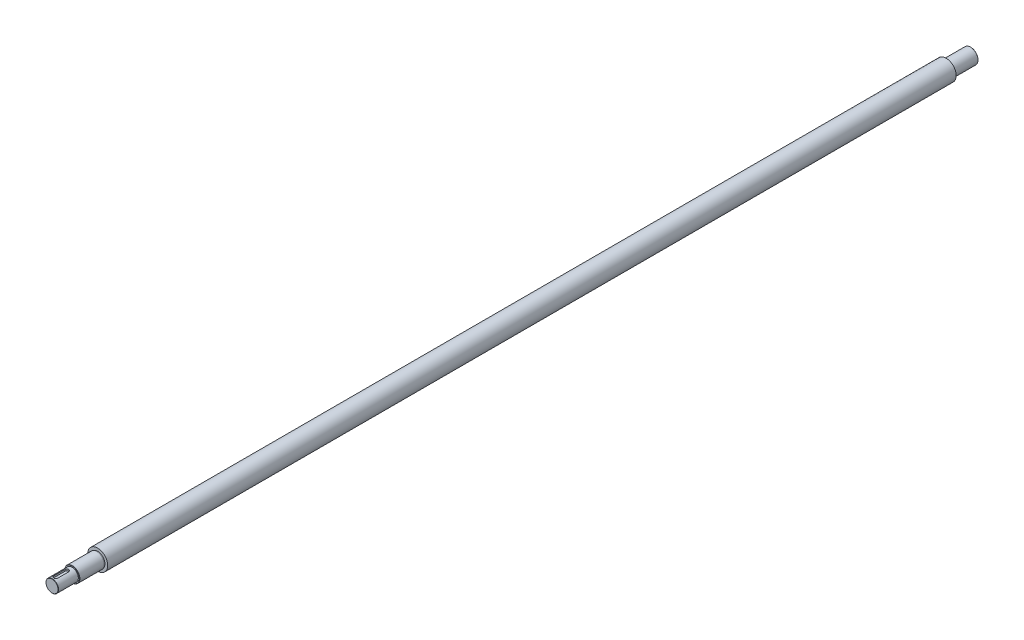
from build123d import *

# Parameters (mm, degrees)
SKETCH_1_R          = 12.5
EXTRUDE_1_DEPTH     = 40
CHAMFER_1_SIZE      = 0.5
SKETCH_2_R          = 15
EXTRUDE_2_DEPTH     = 49
CHAMFER_2_SIZE      = 0.5
CUT_EXTRUDE_1_DEPTH = 4
SKETCH_11_R         = 14.5
EXTRUDE_3_DEPTH     = 2
SKETCH_12_R         = 20
EXTRUDE_4_DEPTH     = 1691
SKETCH_13_R         = 14.5
EXTRUDE_5_DEPTH     = 2
SKETCH_14_R         = 15
EXTRUDE_6_DEPTH     = 47
CHAMFER_3_SIZE      = 0.5


with BuildPart() as part:
    # 草图1 → 凸台-拉伸1 (new body)
    with BuildSketch(Plane.XY):
        Circle(SKETCH_1_R)
    extrude(amount=EXTRUDE_1_DEPTH)

    # 倒角1
    chamfer_1_edges = [part.edges().sort_by_distance(p)[0] for p in [
        (-12.5, 0, 40),
    ]]
    chamfer(chamfer_1_edges, length=CHAMFER_1_SIZE)

    # 草图2 → 凸台-拉伸2 (add)
    with BuildSketch(Plane(origin=(0, 0, 0), x_dir=(-1, 0, 0), z_dir=(0, 0, -1))):
        Circle(SKETCH_2_R)
    extrude(amount=EXTRUDE_2_DEPTH)

    # 倒角2
    chamfer_2_edges = [part.edges().sort_by_distance(p)[0] for p in [
        (15, 0, 0),
    ]]
    chamfer(chamfer_2_edges, length=CHAMFER_2_SIZE)

    # 草图5 → 切除-拉伸1 (cut)
    with BuildSketch(Plane(origin=(0, 12.5, 0), x_dir=(1, 0, 0), z_dir=(0, 1, 0))):
        with BuildLine():
            Line((-4, -33), (-4, -11))
            ThreePointArc((-4, -11), (0, -7), (4, -11))
            Line((4, -11), (4, -33))
            ThreePointArc((4, -33), (0, -37), (-4, -33))
        make_face()
    extrude(amount=-CUT_EXTRUDE_1_DEPTH, mode=Mode.SUBTRACT)

    # 草图11 → 凸台-拉伸3 (add)
    with BuildSketch(Plane(origin=(0, 0, -49), x_dir=(-1, 0, 0), z_dir=(0, 0, -1))):
        Circle(SKETCH_11_R)
    extrude(amount=EXTRUDE_3_DEPTH)

    # 草图12 → 凸台-拉伸4 (add)
    with BuildSketch(Plane(origin=(0, 0, -51), x_dir=(-1, 0, 0), z_dir=(0, 0, -1))):
        Circle(SKETCH_12_R)
    extrude(amount=EXTRUDE_4_DEPTH)

    # 草图13 → 凸台-拉伸5 (add)
    with BuildSketch(Plane(origin=(0, 0, -1742), x_dir=(-1, 0, 0), z_dir=(0, 0, -1))):
        Circle(SKETCH_13_R)
    extrude(amount=EXTRUDE_5_DEPTH)

    # 草图14 → 凸台-拉伸6 (add)
    with BuildSketch(Plane(origin=(0, 0, -1744), x_dir=(-1, 0, 0), z_dir=(0, 0, -1))):
        Circle(SKETCH_14_R)
    extrude(amount=EXTRUDE_6_DEPTH)

    # 倒角3
    chamfer_3_edges = [part.edges().sort_by_distance(p)[0] for p in [
        (15, 0, -1791),
    ]]
    chamfer(chamfer_3_edges, length=CHAMFER_3_SIZE)


solid = part.part
